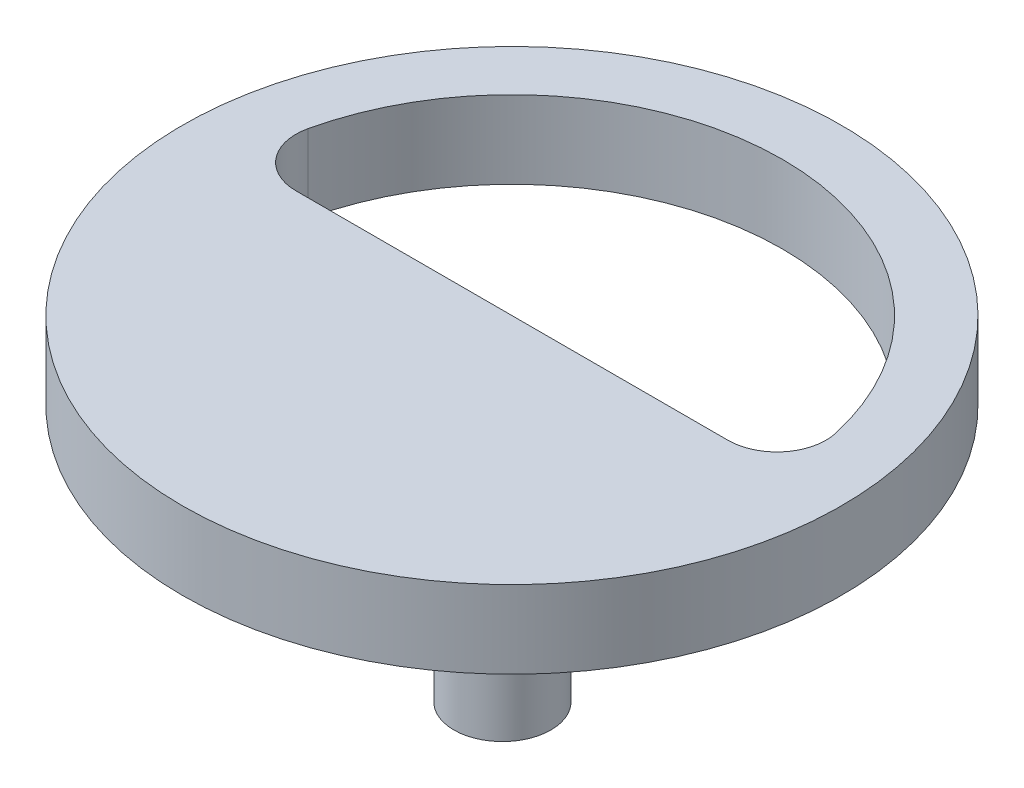
from build123d import *

# Parameters (mm, degrees)
SKETCH_1_R      = 8.490267481
EXTRUDE_1_DEPTH = 2
SKETCH_2_R      = 1.25
EXTRUDE_2_DEPTH = 2.5


with BuildPart() as part:
    # Эскиз1 → Бобышка-Вытянуть1 (new body)
    with BuildSketch(Plane(origin=(0, 0, 0), x_dir=(1, 0, 0), z_dir=(0, 1, 0))):
        with Locations(Location((0, 0, 0), (0, 0, 270))):
            Circle(SKETCH_1_R)
        with BuildLine():
            Line((5.565646409, 0), (-5.565646409, 0))
            ThreePointArc((-5.565646409, 0), (-6.552289655, 0.474742908), (-6.796984316, 1.5419684))
            ThreePointArc((-6.796984316, 1.5419684), (0, 6.969696), (6.796984316, 1.5419684))
            ThreePointArc((6.796984316, 1.5419684), (6.552289655, 0.474742908), (5.565646409, 0))
        make_face(mode=Mode.SUBTRACT)
    extrude(amount=EXTRUDE_1_DEPTH)

    # Эскиз2 → Бобышка-Вытянуть2 (add)
    with BuildSketch(Plane.XZ):
        with Locations(Location((-4, 4.24513374, 0), (0, 0, 90))):
            Circle(SKETCH_2_R)
        with Locations(Location((4, 4.24513374, 0), (0, 0, 90))):
            Circle(SKETCH_2_R)
    extrude(amount=EXTRUDE_2_DEPTH)


solid = part.part
